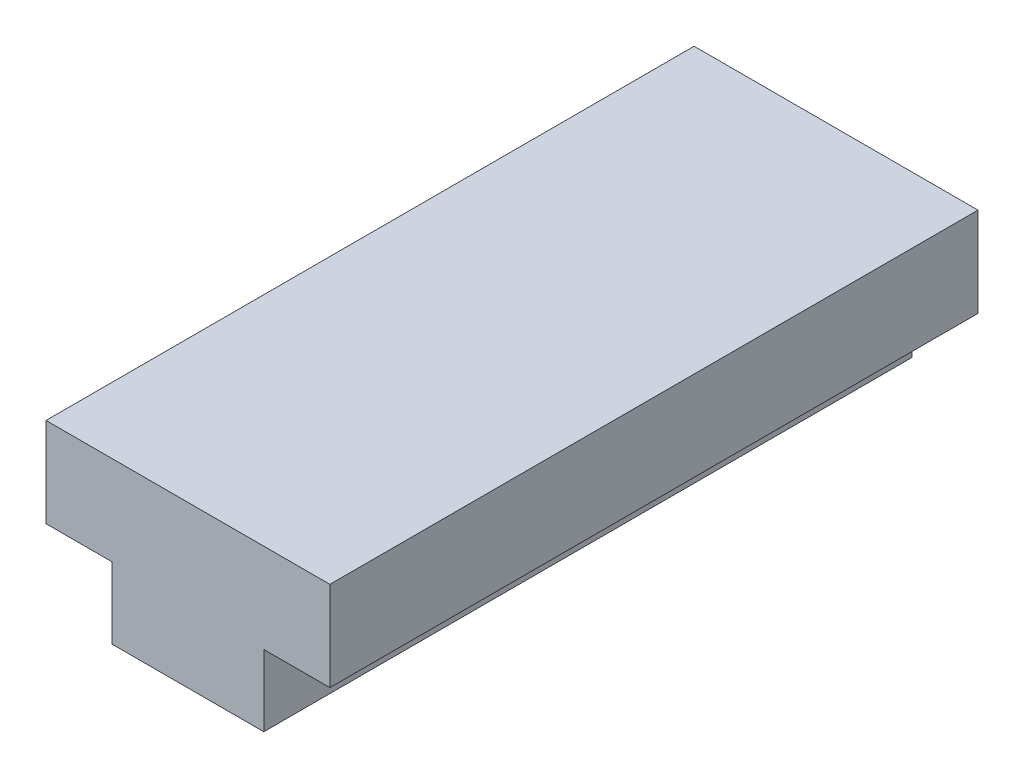
from build123d import *

# Parameters (mm, degrees)
BOSS_EXTRUDE1_DEPTH = 50


with BuildPart() as part:
    # Sketch1 → Boss-Extrude1 (new body)
    with BuildSketch(Plane.XY):
        Polygon((5.85, 0), (5.85, -5.5), (-5.85, -5.5), (-5.85, 0), (-10.95, 0), (-10.95, 6.9), (10.95, 6.9), (10.95, 0), align=None)
    extrude(amount=-BOSS_EXTRUDE1_DEPTH)


solid = part.part
